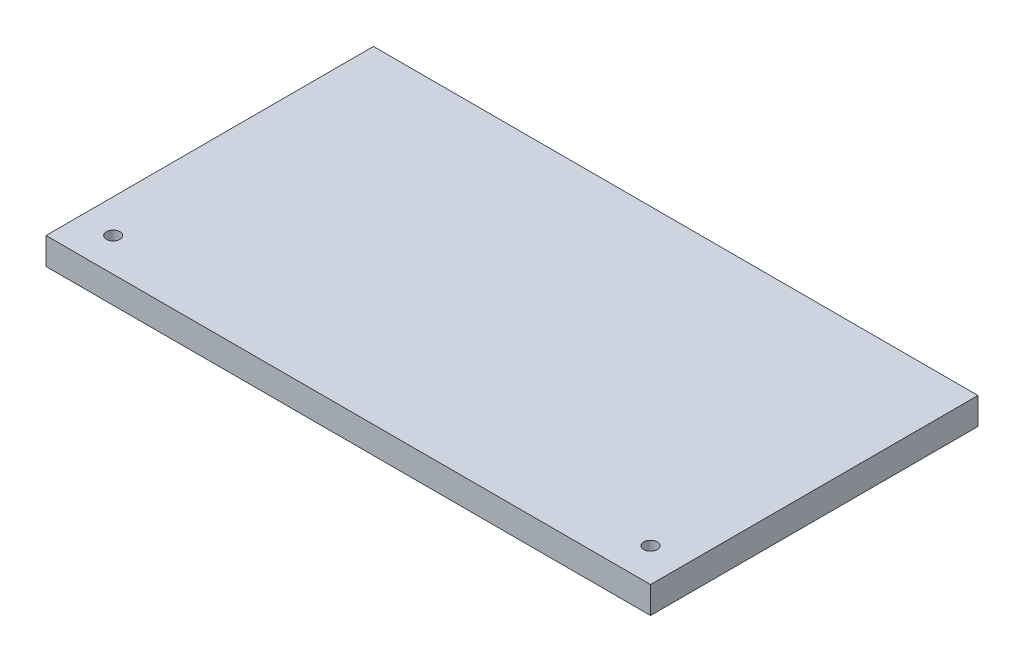
from build123d import *

# Parameters (mm, degrees)
SKETCH_1_W      = 360
SKETCH_1_H      = 195
SKETCH_1_R      = 4
EXTRUDE_1_DEPTH = 16


with BuildPart() as part:
    # Эскиз1 → Бобышка-Вытянуть1 (new body)
    with BuildSketch(Plane(origin=(0, 0, 0), x_dir=(1, 0, 0), z_dir=(0, 1, 0))):
        with Locations((-180, 97.5)):
            Rectangle(SKETCH_1_W, SKETCH_1_H)
        with Locations(Location((-340, 20, 0), (0, 0, 270))):
            Circle(SKETCH_1_R, mode=Mode.SUBTRACT)
        with Locations(Location((-20, 20, 0), (0, 0, 270))):
            Circle(SKETCH_1_R, mode=Mode.SUBTRACT)
    extrude(amount=EXTRUDE_1_DEPTH)


solid = part.part
